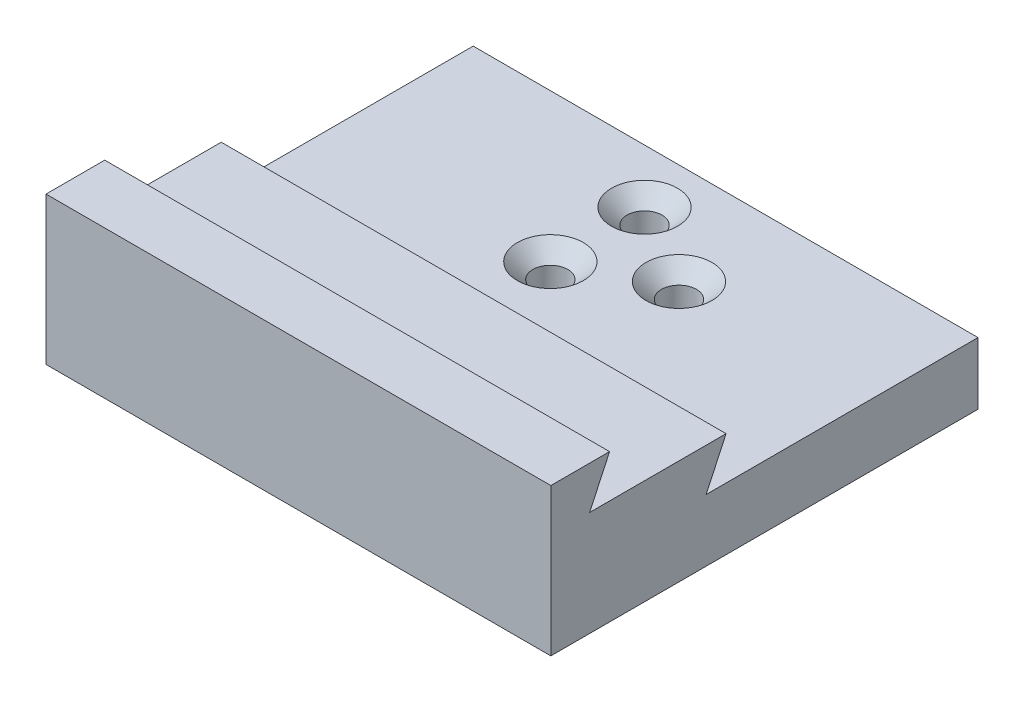
from build123d import *

# Parameters (mm, degrees)
BOSS_EXTRUDE1_DEPTH = 65
SKETCH2_R           = 2
M_DRILL_DEPTH       = 20
SKETCH3_R           = 2.25
M4_THROUGH_DEPTH    = 8
CHAMFER1_SIZE       = 2


with BuildPart() as part:
    # Sketch1 → Boss-Extrude1 (new body)
    with BuildSketch(Plane(origin=(0, 0, 0), x_dir=(0, 0, -1), z_dir=(1, 0, 0))):
        Polygon((0, 0), (0, 19), (7.56469212, 19), (5, 13.5), (22.56469212, 13.5), (20, 8), (55, 8), (55, 0), align=None)
    extrude(amount=BOSS_EXTRUDE1_DEPTH)

    # Sketch2 → M$_DRILL (cut)
    with BuildSketch(Plane(origin=(0, 0, -55), x_dir=(-1, 0, 0), z_dir=(0, 0, -1))):
        with Locations((-12.5, 4.5)):
            Circle(SKETCH2_R)
        with Locations(Location((-52.5, 4.5, 0), (0, 0, 180))):
            Circle(SKETCH2_R)
    extrude(amount=-M_DRILL_DEPTH, mode=Mode.SUBTRACT)

    # Sketch3 → M4_through (cut)
    with BuildSketch(Plane(origin=(0, 8, 0), x_dir=(1, 0, 0), z_dir=(0, 1, 0))):
        with Locations(Location((39.5, 42, 0), (0, 0, 270))):
            Circle(SKETCH3_R)
        with Locations(Location((29, 35.937822174, 0), (0, 0, 270))):
            Circle(SKETCH3_R)
        with Locations(Location((29, 48.062177826, 0), (0, 0, 270))):
            Circle(SKETCH3_R)
    extrude(amount=-M4_THROUGH_DEPTH, mode=Mode.SUBTRACT)

    # Chamfer1
    chamfer1_edges = [part.edges().sort_by_distance(p)[0] for p in [
        (39.5, 8, -44.25),
        (29, 8, -38.187822174),
        (29, 8, -50.312177826),
    ]]
    chamfer(chamfer1_edges, length=CHAMFER1_SIZE)


solid = part.part
